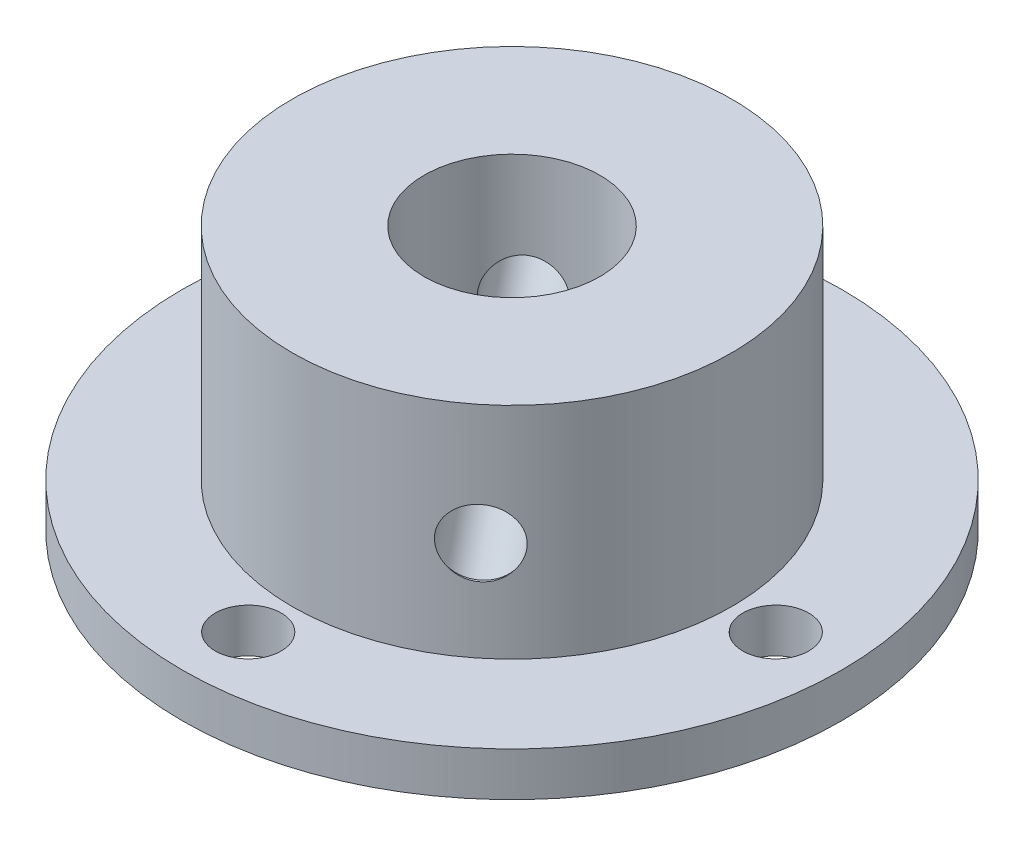
from build123d import *

# Parameters (mm, degrees)
SKETCH1_R                          = 15
BOSS_EXTRUDE1_DEPTH                = 2
SKETCH2_R                          = 10
BOSS_EXTRUDE2_DEPTH                = 10
SKETCH3_R                          = 4
CUT_EXTRUDE1_DEPTH                 = 25.372115214
SKETCH4_R                          = 1.5
CUT_EXTRUDE2_DEPTH                 = 10
F_3_0_3_DIAMETER_HOLE2_D           = 3
F_3_0_3_DIAMETER_HOLE2_CSINK_D     = 3.05
F_3_0_3_DIAMETER_HOLE2_CSINK_ANGLE = 45


with BuildPart() as part:
    # Sketch1 → Boss-Extrude1 (new body)
    with BuildSketch(Plane(origin=(0, 0, 0), x_dir=(1, 0, 0), z_dir=(0, 1, 0))):
        with Locations(Location((0, 0, 0), (0, 0, 270))):
            Circle(SKETCH1_R)
    extrude(amount=BOSS_EXTRUDE1_DEPTH)

    # Sketch2 → Boss-Extrude2 (add)
    with BuildSketch(Plane(origin=(0, 2, 0), x_dir=(1, 0, 0), z_dir=(0, 1, 0))):
        with Locations(Location((0, 0, 0), (0, 0, 270))):
            Circle(SKETCH2_R)
    extrude(amount=BOSS_EXTRUDE2_DEPTH)

    # Sketch3 → Cut-Extrude1 (cut, through all)
    with BuildSketch(Plane(origin=(0, 12, 0), x_dir=(1, 0, 0), z_dir=(0, 1, 0))):
        with Locations(Location((0, 0, 0), (0, 0, 270))):
            Circle(SKETCH3_R)
    extrude(amount=-CUT_EXTRUDE1_DEPTH, mode=Mode.SUBTRACT)

    # Sketch4 → Cut-Extrude2 (cut)
    with BuildSketch(Plane(origin=(0, 2, 0), x_dir=(1, 0, 0), z_dir=(0, 1, 0))):
        with Locations(Location((-12, 0, 0), (0, 0, 270))):
            Circle(SKETCH4_R)
        with Locations(Location((0, 12, 0), (0, 0, 270))):
            Circle(SKETCH4_R)
        with Locations(Location((12, 0, 0), (0, 0, 270))):
            Circle(SKETCH4_R)
        with Locations(Location((0, -12, 0), (0, 0, 270))):
            Circle(SKETCH4_R)
    extrude(amount=-CUT_EXTRUDE2_DEPTH, mode=Mode.SUBTRACT)

    # Ø3.0 (3) Diameter Hole2 (through all)
    with Locations(Plane(origin=(6.317328185, 6.536355403, 7.751862009), x_dir=(0.775186200902, 0, -0.631732818469), z_dir=(0.631732818469, 0, 0.775186200902))):
        with Locations((0, 0)):
            CounterSinkHole(F_3_0_3_DIAMETER_HOLE2_D / 2, F_3_0_3_DIAMETER_HOLE2_CSINK_D / 2, counter_sink_angle=F_3_0_3_DIAMETER_HOLE2_CSINK_ANGLE)


solid = part.part
